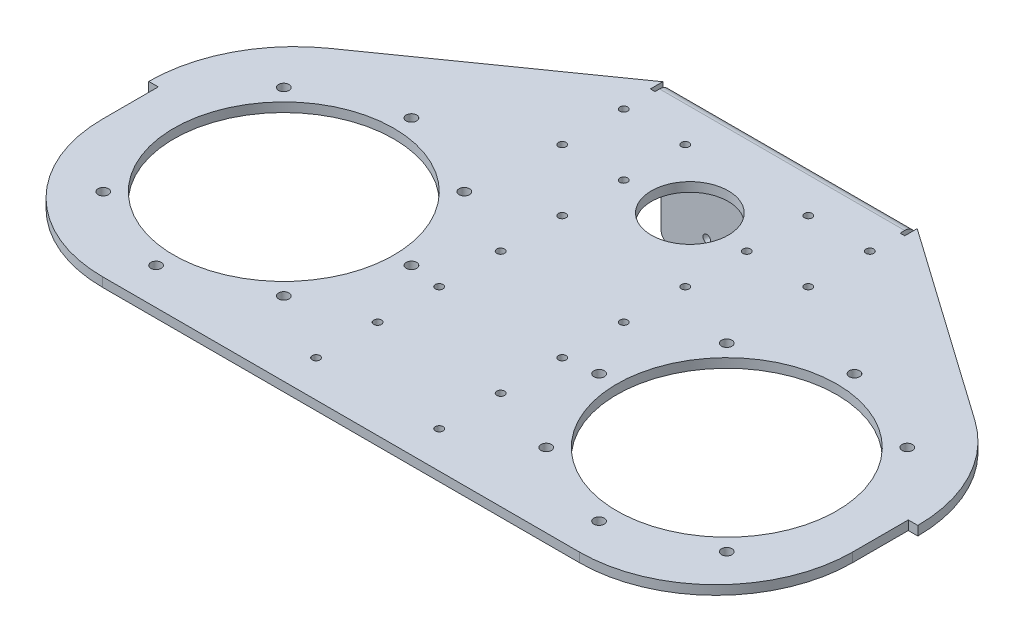
from build123d import *

# Parameters (mm, degrees)
EXTRUDE_1_DEPTH             = 3
SKETCH_2_W                  = 243.8
SKETCH_2_H                  = 3
EXTRUDE_2_DEPTH             = 62.5
SKETCH_3_W                  = 79.68324927
SKETCH_3_H                  = 3
EXTRUDE_3_DEPTH             = 5
SKETCH_4_W                  = 79.68324927
SKETCH_4_H                  = 3
EXTRUDE_4_DEPTH             = 40
HOLE_WIZARD_2_5_2_5_1_D     = 2.5
HOLE_WIZARD_2_5_2_5_2_D     = 2.5
HOLE_WIZARD_2_5_2_5_2_DEPTH = 43
HOLE_WIZARD_25_0_25_1_D     = 25
HOLE_WIZARD_25_0_25_1_DEPTH = 43
HOLE_WIZARD_3_4_3_4_1_D     = 3.4
HOLE_WIZARD_3_4_3_4_1_DEPTH = 43
HOLE_WIZARD_M641_D          = 71.5
FILLET_1_R                  = 0.5
FILLET_2_R                  = 3
FILLET_3_R                  = 3.5
FILLET_4_R                  = 44.4


with BuildPart() as part:
    # Эскиз1 → Бобышка-Вытянуть1 (new body)
    with BuildSketch(Plane(origin=(0, 3, 0), x_dir=(1, 0, 0), z_dir=(0, 1, 0))):
        with BuildLine():
            Line((-124.999894737, 9.1), (124.999894737, 9.1))
            ThreePointArc((124.999894737, 9.1), (119.638879443, 30.921789092), (104.847515108, 47.837654582))
            Line((104.847515108, 47.837654582), (41.341624635, 92.555295631))
            Line((41.341624635, 92.555295631), (41.341624635, 88.5))
            Line((41.341624635, 88.5), (-41.341624635, 88.5))
            Line((-41.341624635, 88.5), (-41.341624635, 92.555295683))
            Line((-41.341624635, 92.555295683), (-104.847515108, 47.837654634))
            ThreePointArc((-104.847515108, 47.837654634), (-119.638879455, 30.921789121), (-124.999894737, 9.1))
        make_face()
    extrude(amount=-EXTRUDE_1_DEPTH)

    # Эскиз2 → Бобышка-Вытянуть2 (add)
    with BuildSketch(Plane.XY.offset(-9.1)):
        with Locations((2e-09, 1.5)):
            Rectangle(SKETCH_2_W, SKETCH_2_H)
    extrude(amount=EXTRUDE_2_DEPTH)

    # Эскиз3 → Бобышка-Вытянуть3 (add)
    with BuildSketch(Plane(origin=(0, 0, -88.5), x_dir=(-1, 0, 0), z_dir=(0, 0, -1))):
        with Locations((0, 1.5)):
            Rectangle(SKETCH_3_W, SKETCH_3_H)
    extrude(amount=EXTRUDE_3_DEPTH)

    # Эскиз4 → Бобышка-Вытянуть4 (add)
    with BuildSketch(Plane.XZ):
        with Locations((0, -92)):
            Rectangle(SKETCH_4_W, SKETCH_4_H)
    extrude(amount=EXTRUDE_4_DEPTH)

    # Диаметр отверстия Ø2.5 (2.5)1 (through all)
    with Locations(Plane.XY.offset(-90.5)):
        with Locations((25, -16), (25, -32), (0, -16), (0, -32), (-25, -16), (-25, -32)):
            Hole(HOLE_WIZARD_2_5_2_5_1_D / 2)

    # Диаметр отверстия Ø2.5 (2.5)2
    with Locations(Plane(origin=(0, 3, 0), x_dir=(1, 0, 0), z_dir=(0, 1, 0))):
        with Locations((-40, 78.5), (20, -41.5), (-20, -41.5), (20, -21.5), (-20, -21.5), (20, -1.5), (-20, -1.5), (20, 18.5), (-20, 18.5), (20, 38.5), (-20, 38.5), (40, 58.5), (40, 78.5), (20, 58.5), (20, 78.5), (-20, 58.5), (-20, 78.5), (-40, 58.5)):
            Hole(HOLE_WIZARD_2_5_2_5_2_D / 2, depth=HOLE_WIZARD_2_5_2_5_2_DEPTH)

    # Диаметр отверстия Ø25.0 (25)1
    with Locations(Plane(origin=(0, 3, 0), x_dir=(1, 0, 0), z_dir=(0, 1, 0))):
        with Locations((0, 60)):
            Hole(HOLE_WIZARD_25_0_25_1_D / 2, depth=HOLE_WIZARD_25_0_25_1_DEPTH)

    # Диаметр отверстия Ø3.4 (3.4)1
    with Locations(Plane(origin=(0, 3, 0), x_dir=(1, 0, 0), z_dir=(0, 1, 0))):
        with Locations((-72, 41.5), (-101.344931419, 29.344931419), (-101.344931419, -29.344931419), (-72, -41.5), (-42.655068581, -29.344931419), (-30.5, 0), (-42.655068581, 29.344931419), (72, 41.5), (101.344931419, 29.344931419), (101.344931419, -29.344931419), (72, -41.5), (42.655068581, -29.344931419), (30.5, 0), (42.655068581, 29.344931419)):
            Hole(HOLE_WIZARD_3_4_3_4_1_D / 2, depth=HOLE_WIZARD_3_4_3_4_1_DEPTH)

    # Отверстие с зазором M641 (through all)
    with Locations(Plane(origin=(0, 0, 0), x_dir=(-1, 0, 0), z_dir=(0, -1, 0))):
        with Locations((72, 0), (-72, 0)):
            Hole(HOLE_WIZARD_M641_D / 2)

    # Скругление1
    fillet_1_edges = [part.edges().sort_by_distance(p)[0] for p in [
        (0, 0, -90.5),
    ]]
    fillet(fillet_1_edges, radius=FILLET_1_R)

    # Скругление2
    fillet_2_edges = [part.edges().sort_by_distance(p)[0] for p in [
        (39.841624635, -40, -92),
        (-39.841624635, -40, -92),
    ]]
    fillet(fillet_2_edges, radius=FILLET_2_R)

    # Скругление3
    fillet_3_edges = [part.edges().sort_by_distance(p)[0] for p in [
        (0, 3, -93.5),
    ]]
    fillet(fillet_3_edges, radius=FILLET_3_R)

    # Скругление4
    fillet_4_edges = [part.edges().sort_by_distance(p)[0] for p in [
        (-121.899999998, 1.5, 53.4),
        (121.900000002, 1.5, 53.4),
    ]]
    fillet(fillet_4_edges, radius=FILLET_4_R)


solid = part.part
